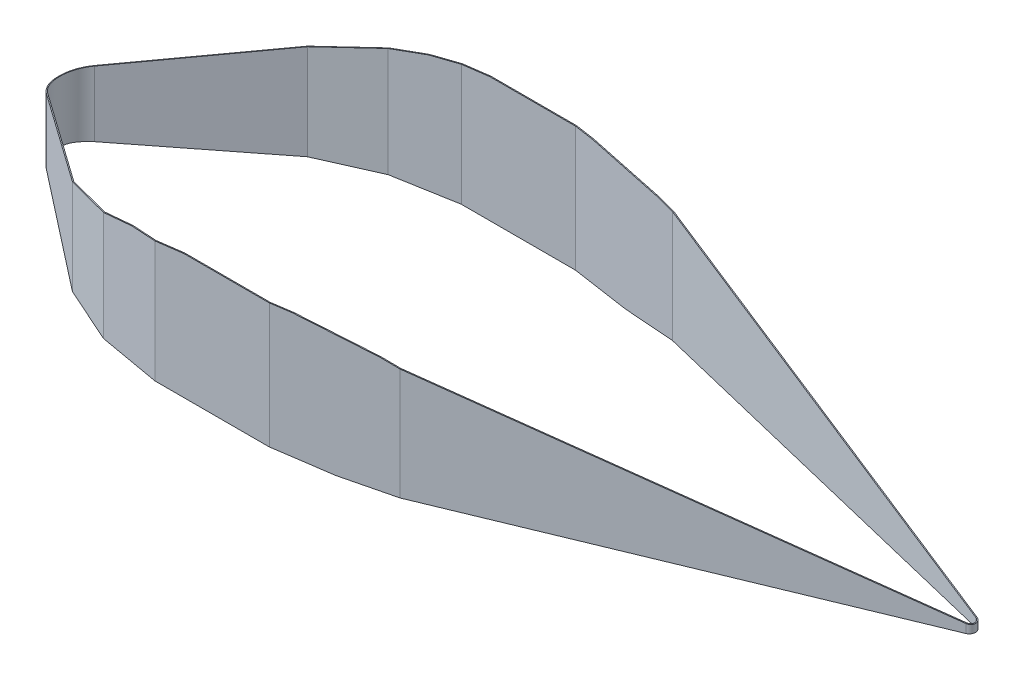
from build123d import *

# Parameters (mm, degrees)
TOPVIEW_EXTRUDE_DEPTH      = 800
SHELL1_T                   = -5
SIDEPROFILE_CUT_DEPTH      = 5006.734380578
SIDEPROFILE_CUT_DEPTH_BACK = 5006.734380578
SKETCH2_OUTSIDE_W          = 5798.358
SKETCH2_OUTSIDE_H          = 1822.06


with BuildPart() as part:
    # Sketch1 → TopView_Extrude (new body)
    with BuildSketch(Plane(origin=(0, 0, 0), x_dir=(1, 0, 0), z_dir=(0, 1, 0))):
        with BuildLine():
            Line((161.409759475, 126.088702216), (784.13, 612.54))
            Line((784.13, 612.54), (1076.464, 742.696))
            Line((1076.464, 742.696), (1401.451, 800))
            Line((1401.451, 800), (1997.019, 800))
            Line((1997.019, 800), (2590.582, 712.35))
            Line((2590.582, 712.35), (4854.876103105, 28.719585912))
            ThreePointArc((4854.876103105, 28.719585912), (4876.205152462, 0), (4854.876103105, -28.719585912))
            Line((4854.876103105, -28.719585912), (2590.582, -712.35))
            Line((2590.582, -712.35), (1997.019, -800))
            Line((1997.019, -800), (1401.451, -800))
            Line((1401.451, -800), (1076.464, -742.696))
            Line((1076.464, -742.696), (784.13, -612.54))
            Line((784.13, -612.54), (161.409759475, -126.088702216))
            ThreePointArc((161.409759475, -126.088702216), (99.906658784, 0), (161.409759475, 126.088702216))
        make_face()
    extrude(amount=TOPVIEW_EXTRUDE_DEPTH)

    # Shell1
    shell1_openings = [part.faces().sort_by_distance(p)[0] for p in [
        (2160.780992179, 0, 0),
        (2160.780992179, 800, 0),
    ]]
    offset(amount=SHELL1_T, openings=shell1_openings, kind=Kind.INTERSECTION)

    # Sketch2 outside → SideProfile_Cut (cut, two sides: drawn at the far end of the back side and taken through both)
    with BuildSketch(Plane.XY.offset(-SIDEPROFILE_CUT_DEPTH_BACK)):
        with Locations((2488.056, 400)):
            Rectangle(SKETCH2_OUTSIDE_W, SKETCH2_OUTSIDE_H)
        with BuildLine():
            Line((0, 300), (0, 332.854109989))
            ThreePointArc((0, 332.854109989), (31.780435884, 425.180350356), (113.655128803, 478.384348558))
            Line((113.655128803, 478.384348558), (1255.921, 763.655))
            Line((1255.921, 763.655), (1551.451, 800))
            Line((1551.451, 800), (2101.451, 800))
            Line((2101.451, 800), (2499.002, 768.799))
            Line((2499.002, 768.799), (4950, 381.685))
            Line((4950, 381.685), (4950, 359.158))
            Line((4950, 359.158), (2301.451, 150))
            Line((2301.451, 150), (150, 150))
            ThreePointArc((150, 150), (43.933982822, 193.933982822), (0, 300))
        make_face(mode=Mode.SUBTRACT)
    extrude(amount=SIDEPROFILE_CUT_DEPTH + SIDEPROFILE_CUT_DEPTH_BACK, mode=Mode.SUBTRACT)


solid = part.part
